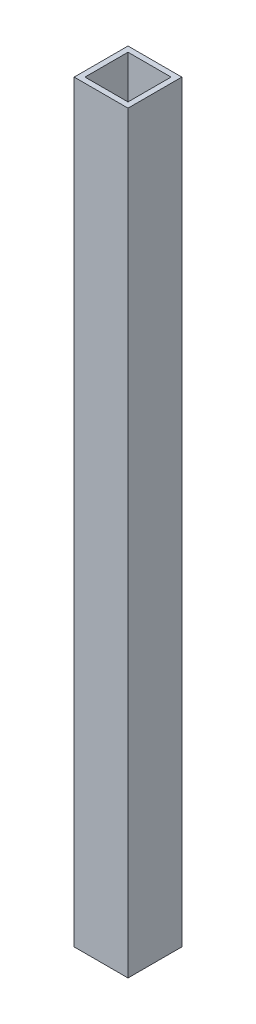
from build123d import *

# Parameters (mm, degrees)
SKETCH1_W           = 50
SKETCH1_H           = 50
SKETCH1_W_2         = 40
SKETCH1_H_2         = 40
BOSS_EXTRUDE1_DEPTH = 700


with BuildPart() as part:
    # Sketch1 → Boss-Extrude1 (new body)
    with BuildSketch(Plane(origin=(0, 0, 0), x_dir=(1, 0, 0), z_dir=(0, 1, 0))):
        with Locations((25, 25)):
            Rectangle(SKETCH1_W, SKETCH1_H)
        with Locations((25, 25)):
            Rectangle(SKETCH1_W_2, SKETCH1_H_2, mode=Mode.SUBTRACT)
    extrude(amount=BOSS_EXTRUDE1_DEPTH)


solid = part.part
